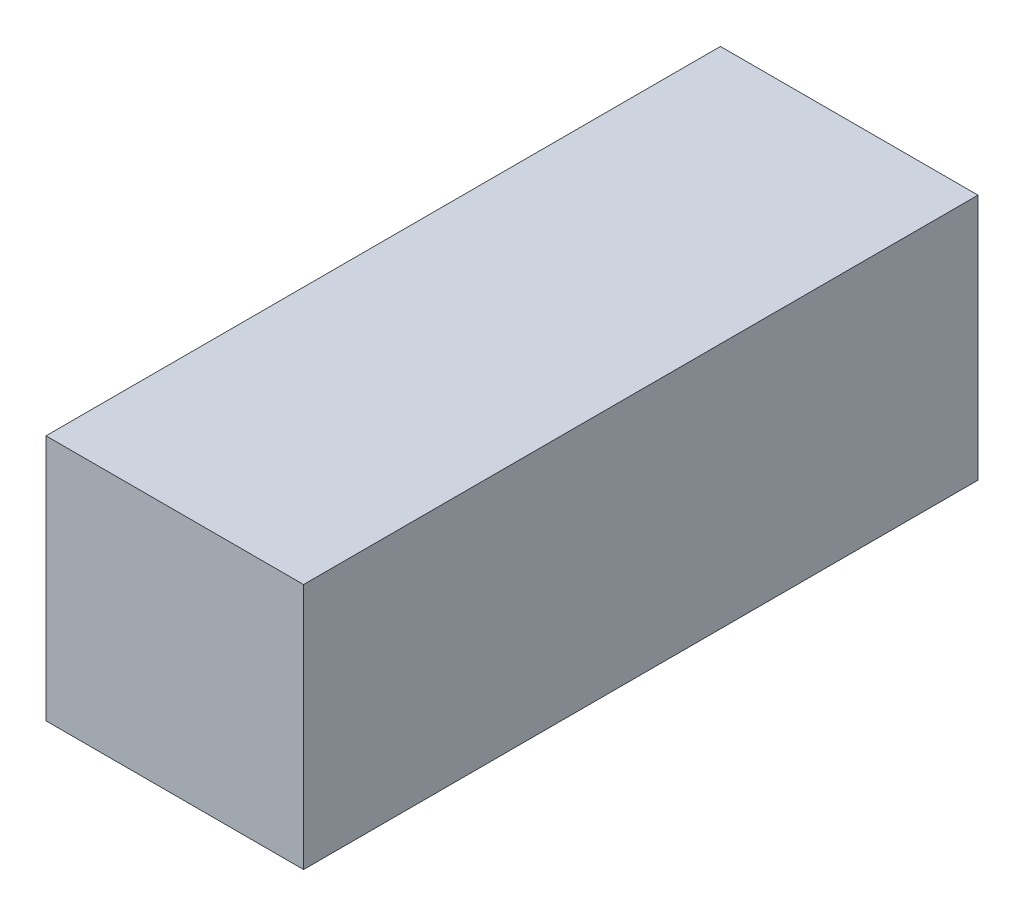
from build123d import *

# Parameters (mm, degrees)
SKETCH1_W           = 2.425264644
SKETCH1_H           = 2.32426129
BOSS_EXTRUDE1_DEPTH = 6.35


with BuildPart() as part:
    # Sketch1 → Boss-Extrude1 (new body)
    with BuildSketch(Plane.XY):
        Rectangle(SKETCH1_W, SKETCH1_H)
    extrude(amount=BOSS_EXTRUDE1_DEPTH)


solid = part.part
